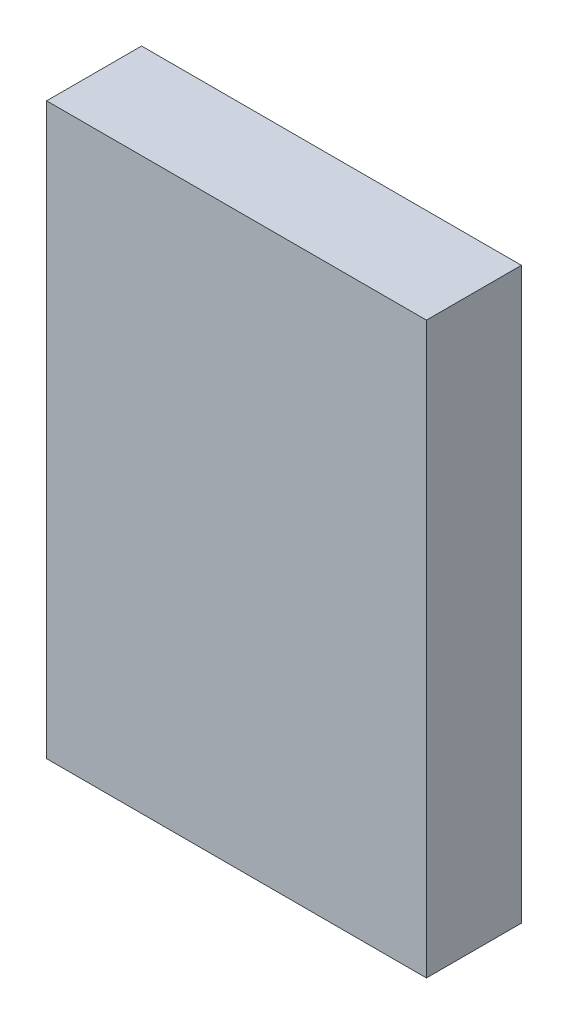
from build123d import *

# Parameters (mm, degrees)
ESQUISSE2_W        = 40
ESQUISSE2_H        = 60
BOSS_EXTRU_1_DEPTH = 5
ESQUISSE3_W        = 40
ESQUISSE3_H        = 60
BOSS_EXTRU_2_DEPTH = 5


with BuildPart() as part:
    # Esquisse2 → Boss.-Extru.1 (new body)
    with BuildSketch(Plane.XY):
        with Locations((5, -165.745255904)):
            Rectangle(ESQUISSE2_W, ESQUISSE2_H)
        with BuildLine():
            Line((9.5, -169.713882871), (7.469689731, -182.633370102))
            ThreePointArc((7.469689731, -182.633370102), (5, -184.745255904), (2.530310269, -182.633370102))
            Line((2.530310269, -182.633370102), (0.5, -169.713882871))
            ThreePointArc((0.5, -169.713882871), (-1, -165.745255904), (0.5, -161.776628937))
            Line((0.5, -161.776628937), (2.530310269, -148.857141706))
            ThreePointArc((2.530310269, -148.857141706), (5, -146.745255904), (7.469689731, -148.857141706))
            Line((7.469689731, -148.857141706), (9.5, -161.776628937))
            ThreePointArc((9.5, -161.776628937), (11, -165.745255904), (9.5, -169.713882871))
        make_face(mode=Mode.SUBTRACT)
    extrude(amount=BOSS_EXTRU_1_DEPTH)

    # Esquisse3 → Boss.-Extru.2 (add)
    with BuildSketch(Plane.XY.offset(5)):
        with Locations((5, -165.745255904)):
            Rectangle(ESQUISSE3_W, ESQUISSE3_H)
    extrude(amount=BOSS_EXTRU_2_DEPTH)


solid = part.part
